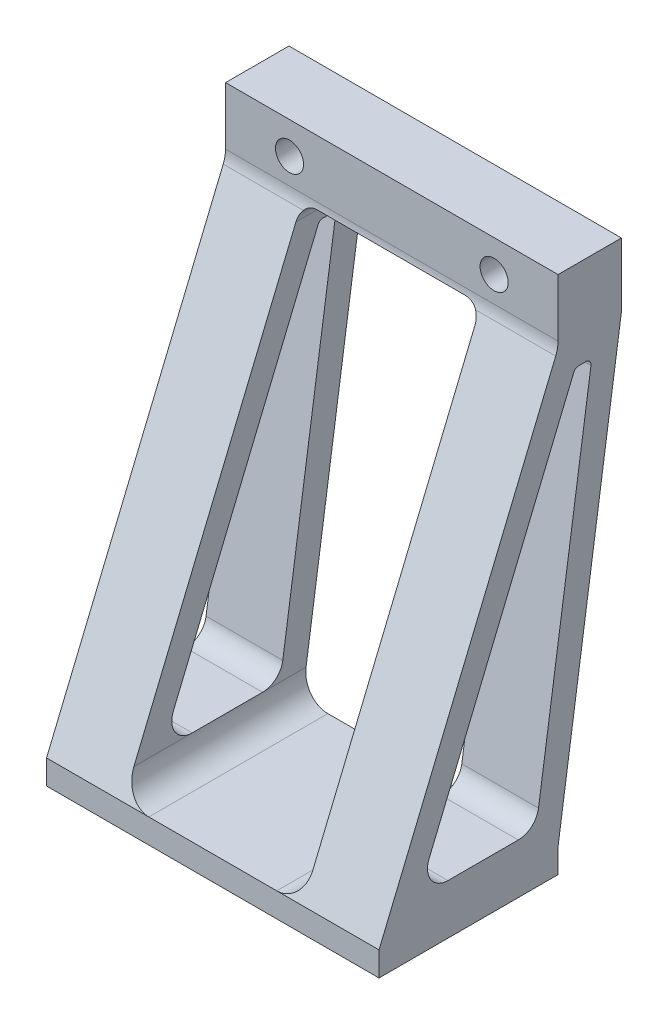
from build123d import *

# Parameters (mm, degrees)
BOSS_EXTRUDE1_DEPTH = 65
SKETCH2_W           = 35.00000000000001
SKETCH2_H           = 96.83750000000002
CUT_EXTRUDE1_DEPTH  = 130.59080671274705
FILLET1_R           = 5
CUT_EXTRUDE2_DEPTH  = 130.59080671274705
BOSS_EXTRUDE2_DEPTH = 35
SKETCH5_R           = 2.7500000000000084
SKETCH5_R_2         = 2.7499999999999956
CUT_EXTRUDE3_DEPTH  = 130.59080671274705
FILLET3_R           = 3


with BuildPart() as part:
    # Sketch1 → Boss-Extrude1 (new body)
    with BuildSketch(Plane(origin=(0, 0, 0), x_dir=(0, 0, -1), z_dir=(1, 0, 0))):
        with BuildLine():
            Line((47.39427375180004, 101.60000000000002), (47.39427375180004, 89.13544686995567))
            Line((47.39427375180004, 89.13544686995567), (35.000000000000014, 4.762500000000003))
            Line((35.000000000000014, 4.762500000000003), (35.000000000000014, 0))
            Line((35.000000000000014, 0), (0, 0))
            Line((0, 0), (0, 4.762500000000003))
            Line((0, 4.762500000000003), (34.54207855565439, 88.03155596440176))
            ThreePointArc((34.54207855565439, 88.03155596440176), (34.88440614395058, 89.15847126507197), (35.000000000000014, 90.3305481964365))
            Line((35.000000000000014, 90.3305481964365), (35.000000000000014, 101.60000000000002))
            Line((35.000000000000014, 101.60000000000002), (47.39427375180004, 101.60000000000002))
        make_face()
    extrude(amount=BOSS_EXTRUDE1_DEPTH)

    # Sketch2 → Cut-Extrude1 (cut, through all)
    with BuildSketch(Plane.XY):
        with Locations((32.50000000000001, 53.18125000000001)):
            Rectangle(SKETCH2_W, SKETCH2_H)
    extrude(amount=-CUT_EXTRUDE1_DEPTH, mode=Mode.SUBTRACT)

    # Fillet1
    fillet1_edges = [part.edges().sort_by_distance(p)[0] for p in [
        (50, 4.762500000000003, -17.500000000000007),
        (15, 4.762500000000003, -17.500000000000007),
    ]]
    fillet(fillet1_edges, radius=FILLET1_R)

    # Sketch3 → Cut-Extrude2 (cut, through all)
    with BuildSketch(Plane(origin=(65, 0, 0), x_dir=(0, 0, -1), z_dir=(1, 0, 0))):
        with BuildLine():
            Line((38.08312858614837, 83.51861224196143), (9.782341841456388, 15.295161488023126))
            ThreePointArc((9.782341841456388, 15.295161488023126), (10.15060285597038, 11.541086705731292), (13.477060878559312, 9.762500000000001))
            Line((13.477060878559312, 9.762500000000001), (27.225499843288624, 9.762500000000001))
            ThreePointArc((27.225499843288624, 9.762500000000001), (29.84032084558306, 10.735502952436189), (31.18302757021517, 13.181144437020006))
            Line((31.18302757021517, 13.181144437020006), (41.43787152872858, 82.99010797921063))
            ThreePointArc((41.43787152872858, 82.99010797921063), (41.20523885888791, 83.78915212052925), (40.44848959699694, 84.13544686995566))
            Line((40.44848959699694, 84.13544686995566), (39.006808345424105, 84.13544686995566))
            ThreePointArc((39.006808345424105, 84.13544686995566), (38.45145502185692, 83.96706137560288), (38.08312858614837, 83.51861224196143))
        make_face()
    extrude(amount=-CUT_EXTRUDE2_DEPTH, mode=Mode.SUBTRACT)

    # Sketch4 → Boss-Extrude2 (add)
    with BuildSketch(Plane(origin=(15, 0, 0), x_dir=(0, 0, -1), z_dir=(1, 0, 0))):
        with BuildLine():
            Line((47.39427375180004, 89.13544686995567), (47.39427375180004, 101.60000000000002))
            Line((47.39427375180004, 101.60000000000002), (35.000000000000014, 101.60000000000002))
            Line((35.000000000000014, 101.60000000000002), (35.000000000000014, 90.3305481964365))
            ThreePointArc((35.000000000000014, 90.3305481964365), (34.969867635356294, 89.72998145049917), (34.87977319455811, 89.13544686995567))
            Line((34.87977319455811, 89.13544686995567), (47.39427375180004, 89.13544686995567))
        make_face()
    extrude(amount=BOSS_EXTRUDE2_DEPTH)

    # Sketch5 → Cut-Extrude3 (cut, through all)
    with BuildSketch(Plane(origin=(0, 0, -47.39427375180004), x_dir=(-1, 0, 0), z_dir=(0, 0, -1))):
        with Locations((-52.50000000000002, 95.36772343497786)):
            Circle(SKETCH5_R)
        with Locations((-12.499999999999996, 95.36772343497786)):
            Circle(SKETCH5_R_2)
    extrude(amount=-CUT_EXTRUDE3_DEPTH, mode=Mode.SUBTRACT)

    # Fillet3
    fillet3_edges = [part.edges().sort_by_distance(p)[0] for p in [
        (15, 89.13544686995567, -41.13702347317908),
        (50, 89.13544686995567, -41.13702347317908),
    ]]
    fillet(fillet3_edges, radius=FILLET3_R)


solid = part.part
